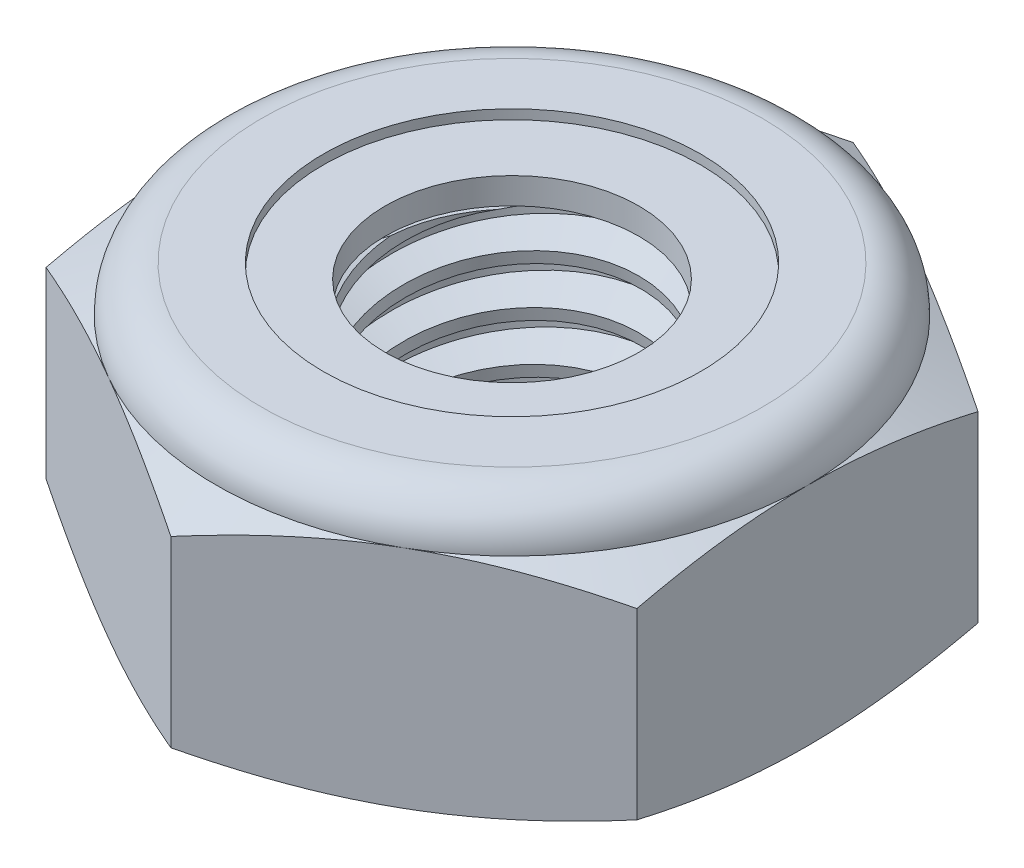
from build123d import *

# Parameters (mm, degrees)
EXTRUDE1_DEPTH      = 4.365625
SKETCH2_W           = 2.413
SKETCH2_H           = 4.365625
LPATTERN1_COUNT     = 6
LPATTERN1_PITCH     = 0.79375
LPATTERN1_COL_COUNT = 2
LPATTERN1_COL_PITCH = 0.79375


with BuildPart() as part:
    # Sketch1 → Extrude1 (new body)
    with BuildSketch(Plane(origin=(0, 0, 0), x_dir=(1, 0, 0), z_dir=(0, 1, 0))):
        Polygon((0, 5.499261314), (-4.7625, 2.749630657), (-4.7625, -2.749630657), (0, -5.499261314), (4.7625, -2.749630657), (4.7625, 2.749630657), align=None)
    extrude(amount=EXTRUDE1_DEPTH)

    # Sketch4 → Cut-Revolve2 (revolve, cut)
    with BuildSketch(Plane(origin=(0, 0, 0), x_dir=(0, 0, -1), z_dir=(1, 0, 0))):
        Polygon((0, 4.365625), (2.413, 4.365625), (2.045424837, 4.194221887), (2.045424837, 0.171403113), (2.413, 0), (0, 0), align=None)
    revolve(axis=Axis((0, 4.365625, 0), (0, 1, 0)), mode=Mode.SUBTRACT)


with BuildPart() as body_2:
    # Sketch2 → Revolve1 (revolve)
    with BuildSketch(Plane(origin=(0, 0, 0), x_dir=(0, 0, -1), z_dir=(1, 0, 0))):
        with Locations((1.2065, 2.1828125)):
            Rectangle(SKETCH2_W, SKETCH2_H)
    revolve(axis=Axis((0, -2.413, 0), (0, 1, 0)))

    # Sketch3 → Cut-Revolve1 (revolve, cut)
    with BuildSketch(Plane(origin=(0, 0, 0), x_dir=(0, 0, -1), z_dir=(1, 0, 0)), mode=Mode.PRIVATE) as cut_revolve1_sk:
        Polygon((2.429102527, 4.267721635), (2.541820218, 3.582398076), (2.077629892, 3.757430502), (2.045424837, 3.953237233), align=None)
    cut_revolve1 = revolve(cut_revolve1_sk.sketch.rotate(Axis((0, 4.365625, 0.139697061), (0, -0.9867425810390565, -0.16229318767089668)), 180), axis=Axis((0, 4.365625, 0.139697061), (0, -0.9867425810390565, -0.16229318767089668)), mode=Mode.SUBTRACT)

    # LPattern1: Cut-Revolve1 ×6
    with Locations(*[(0, -i * LPATTERN1_PITCH, 0) for i in range(1, LPATTERN1_COUNT)]):
        add(cut_revolve1, mode=Mode.SUBTRACT)

    # LPattern1 col: Cut-Revolve1 ×2
    with Locations(*[(0, i * LPATTERN1_COL_PITCH, 0) for i in range(1, LPATTERN1_COL_COUNT)]):
        add(cut_revolve1, mode=Mode.SUBTRACT)


with BuildPart() as part_1:
    add(part.part)

    # Combine1: cut body 2
    add(body_2.part, mode=Mode.SUBTRACT)

    # Sketch5 → Cut-Revolve3 (revolve, cut)
    with BuildSketch(Plane(origin=(0, 0, 0), x_dir=(0, 0, -1), z_dir=(1, 0, 0)), mode=Mode.PRIVATE) as cut_revolve3_sk:
        with BuildLine():
            Line((0, 0), (4.7625, 0))
            Line((4.7625, 0), (5.499261314, 0.343557443))
            Line((5.499261314, 0.343557443), (5.499261314, 3.29446339))
            Line((5.499261314, 3.29446339), (4.7625, 3.638020833))
            ThreePointArc((4.7625, 3.638020833), (4.549389674, 4.152514674), (4.034895833, 4.365625))
            Line((4.034895833, 4.365625), (4.034895833, 5.635625))
            Line((4.034895833, 5.635625), (6.769261314, 5.635625))
            Line((6.769261314, 5.635625), (6.769261314, -1.27))
            Line((6.769261314, -1.27), (0, -1.27))
            Line((0, -1.27), (0, 0))
        make_face()
    revolve(cut_revolve3_sk.sketch.rotate(Axis((0, 0, 0), (0, 1, 0)), 55.135741266), axis=Axis((0, 0, 0), (0, 1, 0)), mode=Mode.SUBTRACT)

    # Sketch6 → Cut-Revolve4 (revolve, cut)
    with BuildSketch(Plane(origin=(0, 0, 0), x_dir=(0, 0, -1), z_dir=(1, 0, 0)), mode=Mode.PRIVATE) as cut_revolve4_sk:
        with BuildLine():
            Line((0, 3.638020833), (4.6101, 3.638020833))
            ThreePointArc((4.6101, 3.638020833), (4.4416266, 4.0447516), (4.034895833, 4.213225))
            Line((4.034895833, 4.213225), (3.040160335, 4.213225))
            Line((3.040160335, 4.213225), (3.040160335, 5.635625))
            Line((3.040160335, 5.635625), (0, 5.635625))
            Line((0, 5.635625), (0, 3.638020833))
        make_face()
    revolve(cut_revolve4_sk.sketch.rotate(Axis((0, 5.635625, 0), (0, 1, 0)), 55.135741266), axis=Axis((0, 5.635625, 0), (0, 1, 0)), mode=Mode.SUBTRACT)


with BuildPart() as body_2_2:
    # Sketch7 → Revolve2 (revolve)
    with BuildSketch(Plane(origin=(0, 0, 0), x_dir=(0, 0, -1), z_dir=(1, 0, 0))):
        with BuildLine():
            Line((2.045424837, 3.714220833), (4.528047654, 3.714220833))
            ThreePointArc((4.528047654, 3.714220833), (4.359688876, 4.016854092), (4.034895833, 4.137025))
            Line((4.034895833, 4.137025), (2.045424837, 4.137025))
            Line((2.045424837, 4.137025), (2.045424837, 3.714220833))
        make_face()
    revolve(axis=Axis((0, 3.714220833, 0), (0, 1, 0)))


solid = Compound([part_1.part, body_2_2.part])
